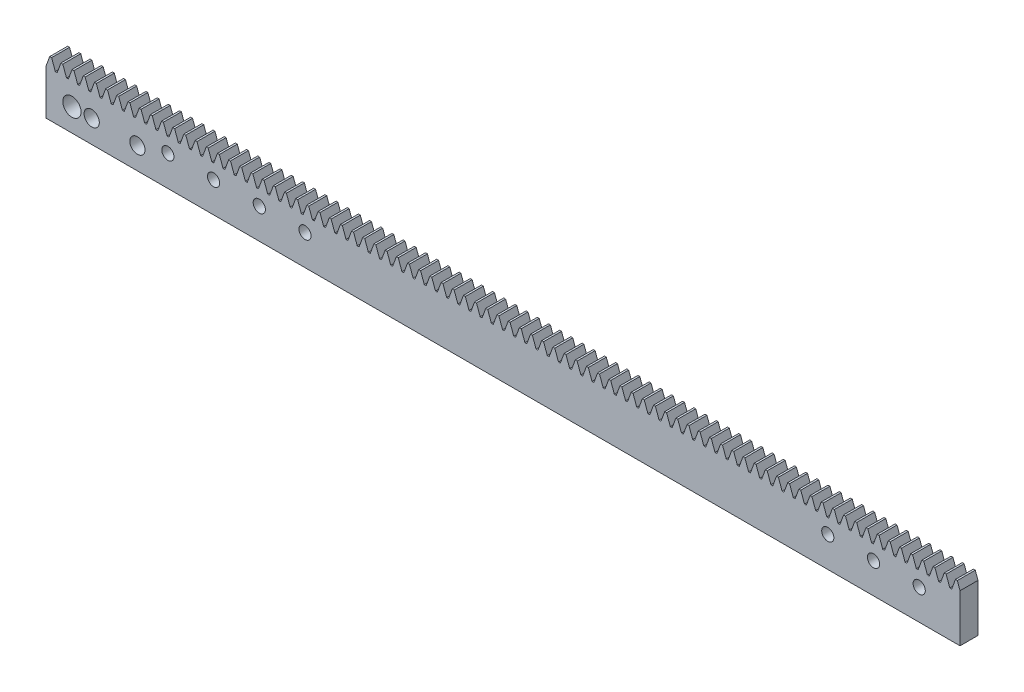
from build123d import *

# Parameters (mm, degrees)
CROQUIS1_R              = 3
CROQUIS1_R_2            = 2
SALIENTE_EXTRUIR1_DEPTH = 5.9
CROQUIS2_R              = 2.5
CROQUIS2_R_2            = 2
CROQUIS2_R_3            = 3
CROQUIS2_W              = 125.0496438
CROQUIS2_H              = 44.615702059
CORTAR_EXTRUIR2_DEPTH   = 16


with BuildPart() as part:
    # Croquis1 → Saliente-Extruir1 (new body)
    with BuildSketch(Plane.XY):
        with BuildLine():
            Line((-151.593916452, 22.65806142), (-152.811970556, 19.311485275))
            Line((-152.811970556, 19.311485275), (-152.811970556, 4.538535699))
            Line((-152.811970556, 4.538535699), (188.488029444, 4.538535699))
            Line((188.488029444, 4.538535699), (188.488029444, 19.311485275))
            Line((188.488029444, 19.311485275), (187.882745302, 19.311485275))
            Line((187.882745302, 19.311485275), (186.664691198, 22.65806142))
            Line((186.664691198, 22.65806142), (186.046083548, 22.65806142))
            Line((186.046083548, 22.65806142), (184.828029444, 19.311485275))
            Line((184.828029444, 19.311485275), (184.212745302, 19.311485275))
            Line((184.212745302, 19.311485275), (182.994691198, 22.65806142))
            Line((182.994691198, 22.65806142), (182.376083548, 22.65806142))
            Line((182.376083548, 22.65806142), (181.158029444, 19.311485275))
            Line((181.158029444, 19.311485275), (180.542745302, 19.311485275))
            Line((180.542745302, 19.311485275), (179.324691198, 22.65806142))
            Line((179.324691198, 22.65806142), (178.706083548, 22.65806142))
            Line((178.706083548, 22.65806142), (177.488029444, 19.311485275))
            Line((177.488029444, 19.311485275), (176.872745302, 19.311485275))
            Line((176.872745302, 19.311485275), (175.654691198, 22.65806142))
            Line((175.654691198, 22.65806142), (175.036083548, 22.65806142))
            Line((175.036083548, 22.65806142), (173.818029444, 19.311485275))
            Line((173.818029444, 19.311485275), (173.202745302, 19.311485275))
            Line((173.202745302, 19.311485275), (171.984691198, 22.65806142))
            Line((171.984691198, 22.65806142), (171.366083548, 22.65806142))
            Line((171.366083548, 22.65806142), (170.148029444, 19.311485275))
            Line((170.148029444, 19.311485275), (169.532745302, 19.311485275))
            Line((169.532745302, 19.311485275), (168.314691198, 22.65806142))
            Line((168.314691198, 22.65806142), (167.696083548, 22.65806142))
            Line((167.696083548, 22.65806142), (166.478029444, 19.311485275))
            Line((166.478029444, 19.311485275), (165.862745302, 19.311485275))
            Line((165.862745302, 19.311485275), (164.644691198, 22.65806142))
            Line((164.644691198, 22.65806142), (164.026083548, 22.65806142))
            Line((164.026083548, 22.65806142), (162.808029444, 19.311485275))
            Line((162.808029444, 19.311485275), (162.192745302, 19.311485275))
            Line((162.192745302, 19.311485275), (160.974691198, 22.65806142))
            Line((160.974691198, 22.65806142), (160.356083548, 22.65806142))
            Line((160.356083548, 22.65806142), (159.138029444, 19.311485275))
            Line((159.138029444, 19.311485275), (158.522745302, 19.311485275))
            Line((158.522745302, 19.311485275), (157.304691198, 22.65806142))
            Line((157.304691198, 22.65806142), (156.686083548, 22.65806142))
            Line((156.686083548, 22.65806142), (155.468029444, 19.311485275))
            Line((155.468029444, 19.311485275), (154.852745302, 19.311485275))
            Line((154.852745302, 19.311485275), (153.634691198, 22.65806142))
            Line((153.634691198, 22.65806142), (153.016083548, 22.65806142))
            Line((153.016083548, 22.65806142), (151.798029444, 19.311485275))
            Line((151.798029444, 19.311485275), (151.182745302, 19.311485275))
            Line((151.182745302, 19.311485275), (149.964691198, 22.65806142))
            Line((149.964691198, 22.65806142), (149.346083548, 22.65806142))
            Line((149.346083548, 22.65806142), (148.128029444, 19.311485275))
            Line((148.128029444, 19.311485275), (147.512745302, 19.311485275))
            Line((147.512745302, 19.311485275), (146.294691198, 22.65806142))
            Line((146.294691198, 22.65806142), (145.676083548, 22.65806142))
            Line((145.676083548, 22.65806142), (144.458029444, 19.311485275))
            Line((144.458029444, 19.311485275), (143.842745302, 19.311485275))
            Line((143.842745302, 19.311485275), (142.624691198, 22.65806142))
            Line((142.624691198, 22.65806142), (142.006083548, 22.65806142))
            Line((142.006083548, 22.65806142), (140.788029444, 19.311485275))
            Line((140.788029444, 19.311485275), (140.172745302, 19.311485275))
            Line((140.172745302, 19.311485275), (138.954691198, 22.65806142))
            Line((138.954691198, 22.65806142), (138.336083548, 22.65806142))
            Line((138.336083548, 22.65806142), (137.118029444, 19.311485275))
            Line((137.118029444, 19.311485275), (136.502745302, 19.311485275))
            Line((136.502745302, 19.311485275), (135.284691198, 22.65806142))
            Line((135.284691198, 22.65806142), (134.666083548, 22.65806142))
            Line((134.666083548, 22.65806142), (133.448029444, 19.311485275))
            Line((133.448029444, 19.311485275), (132.832745302, 19.311485275))
            Line((132.832745302, 19.311485275), (131.614691198, 22.65806142))
            Line((131.614691198, 22.65806142), (130.996083548, 22.65806142))
            Line((130.996083548, 22.65806142), (129.778029444, 19.311485275))
            Line((129.778029444, 19.311485275), (129.162745302, 19.311485275))
            Line((129.162745302, 19.311485275), (127.944691198, 22.65806142))
            Line((127.944691198, 22.65806142), (127.326083548, 22.65806142))
            Line((127.326083548, 22.65806142), (126.108029444, 19.311485275))
            Line((126.108029444, 19.311485275), (125.492745302, 19.311485275))
            Line((125.492745302, 19.311485275), (124.274691198, 22.65806142))
            Line((124.274691198, 22.65806142), (123.656083548, 22.65806142))
            Line((123.656083548, 22.65806142), (122.438029444, 19.311485275))
            Line((122.438029444, 19.311485275), (121.822745302, 19.311485275))
            Line((121.822745302, 19.311485275), (120.604691198, 22.65806142))
            Line((120.604691198, 22.65806142), (119.986083548, 22.65806142))
            Line((119.986083548, 22.65806142), (118.768029444, 19.311485275))
            Line((118.768029444, 19.311485275), (118.152745302, 19.311485275))
            Line((118.152745302, 19.311485275), (116.934691198, 22.65806142))
            Line((116.934691198, 22.65806142), (116.316083548, 22.65806142))
            Line((116.316083548, 22.65806142), (115.098029444, 19.311485275))
            Line((115.098029444, 19.311485275), (114.482745302, 19.311485275))
            Line((114.482745302, 19.311485275), (113.264691198, 22.65806142))
            Line((113.264691198, 22.65806142), (112.646083548, 22.65806142))
            Line((112.646083548, 22.65806142), (111.428029444, 19.311485275))
            Line((111.428029444, 19.311485275), (110.812745302, 19.311485275))
            Line((110.812745302, 19.311485275), (109.594691198, 22.65806142))
            Line((109.594691198, 22.65806142), (108.976083548, 22.65806142))
            Line((108.976083548, 22.65806142), (107.758029444, 19.311485275))
            Line((107.758029444, 19.311485275), (107.142745302, 19.311485275))
            Line((107.142745302, 19.311485275), (105.924691198, 22.65806142))
            Line((105.924691198, 22.65806142), (105.306083548, 22.65806142))
            Line((105.306083548, 22.65806142), (104.088029444, 19.311485275))
            Line((104.088029444, 19.311485275), (103.472745302, 19.311485275))
            Line((103.472745302, 19.311485275), (102.254691198, 22.65806142))
            Line((102.254691198, 22.65806142), (101.636083548, 22.65806142))
            Line((101.636083548, 22.65806142), (100.418029444, 19.311485275))
            Line((100.418029444, 19.311485275), (99.802745302, 19.311485275))
            Line((99.802745302, 19.311485275), (98.584691198, 22.65806142))
            Line((98.584691198, 22.65806142), (97.966083548, 22.65806142))
            Line((97.966083548, 22.65806142), (96.748029444, 19.311485275))
            Line((96.748029444, 19.311485275), (96.132745302, 19.311485275))
            Line((96.132745302, 19.311485275), (94.914691198, 22.65806142))
            Line((94.914691198, 22.65806142), (94.296083548, 22.65806142))
            Line((94.296083548, 22.65806142), (93.078029444, 19.311485275))
            Line((93.078029444, 19.311485275), (92.462745302, 19.311485275))
            Line((92.462745302, 19.311485275), (91.244691198, 22.65806142))
            Line((91.244691198, 22.65806142), (90.626083548, 22.65806142))
            Line((90.626083548, 22.65806142), (89.408029444, 19.311485275))
            Line((89.408029444, 19.311485275), (88.792745302, 19.311485275))
            Line((88.792745302, 19.311485275), (87.574691198, 22.65806142))
            Line((87.574691198, 22.65806142), (86.956083548, 22.65806142))
            Line((86.956083548, 22.65806142), (85.738029444, 19.311485275))
            Line((85.738029444, 19.311485275), (85.122745302, 19.311485275))
            Line((85.122745302, 19.311485275), (83.904691198, 22.65806142))
            Line((83.904691198, 22.65806142), (83.286083548, 22.65806142))
            Line((83.286083548, 22.65806142), (82.068029444, 19.311485275))
            Line((82.068029444, 19.311485275), (81.452745302, 19.311485275))
            Line((81.452745302, 19.311485275), (80.234691198, 22.65806142))
            Line((80.234691198, 22.65806142), (79.616083548, 22.65806142))
            Line((79.616083548, 22.65806142), (78.398029444, 19.311485275))
            Line((78.398029444, 19.311485275), (77.782745302, 19.311485275))
            Line((77.782745302, 19.311485275), (76.564691198, 22.65806142))
            Line((76.564691198, 22.65806142), (75.946083548, 22.65806142))
            Line((75.946083548, 22.65806142), (74.728029444, 19.311485275))
            Line((74.728029444, 19.311485275), (74.112745302, 19.311485275))
            Line((74.112745302, 19.311485275), (72.894691198, 22.65806142))
            Line((72.894691198, 22.65806142), (72.276083548, 22.65806142))
            Line((72.276083548, 22.65806142), (71.058029444, 19.311485275))
            Line((71.058029444, 19.311485275), (70.442745302, 19.311485275))
            Line((70.442745302, 19.311485275), (69.224691198, 22.65806142))
            Line((69.224691198, 22.65806142), (68.606083548, 22.65806142))
            Line((68.606083548, 22.65806142), (67.388029444, 19.311485275))
            Line((67.388029444, 19.311485275), (66.772745302, 19.311485275))
            Line((66.772745302, 19.311485275), (65.554691198, 22.65806142))
            Line((65.554691198, 22.65806142), (64.936083548, 22.65806142))
            Line((64.936083548, 22.65806142), (63.718029444, 19.311485275))
            Line((63.718029444, 19.311485275), (63.102745302, 19.311485275))
            Line((63.102745302, 19.311485275), (61.884691198, 22.65806142))
            Line((61.884691198, 22.65806142), (61.266083548, 22.65806142))
            Line((61.266083548, 22.65806142), (60.048029444, 19.311485275))
            Line((60.048029444, 19.311485275), (59.432745302, 19.311485275))
            Line((59.432745302, 19.311485275), (58.214691198, 22.65806142))
            Line((58.214691198, 22.65806142), (57.596083548, 22.65806142))
            Line((57.596083548, 22.65806142), (56.378029444, 19.311485275))
            Line((56.378029444, 19.311485275), (55.762745302, 19.311485275))
            Line((55.762745302, 19.311485275), (54.544691198, 22.65806142))
            Line((54.544691198, 22.65806142), (53.926083548, 22.65806142))
            Line((53.926083548, 22.65806142), (52.708029444, 19.311485275))
            Line((52.708029444, 19.311485275), (52.092745302, 19.311485275))
            Line((52.092745302, 19.311485275), (50.874691198, 22.65806142))
            Line((50.874691198, 22.65806142), (50.256083548, 22.65806142))
            Line((50.256083548, 22.65806142), (49.038029444, 19.311485275))
            Line((49.038029444, 19.311485275), (48.422745302, 19.311485275))
            Line((48.422745302, 19.311485275), (47.204691198, 22.65806142))
            Line((47.204691198, 22.65806142), (46.586083548, 22.65806142))
            Line((46.586083548, 22.65806142), (45.368029444, 19.311485275))
            Line((45.368029444, 19.311485275), (44.752745302, 19.311485275))
            Line((44.752745302, 19.311485275), (43.534691198, 22.65806142))
            Line((43.534691198, 22.65806142), (42.916083548, 22.65806142))
            Line((42.916083548, 22.65806142), (41.698029444, 19.311485275))
            Line((41.698029444, 19.311485275), (41.082745302, 19.311485275))
            Line((41.082745302, 19.311485275), (39.864691198, 22.65806142))
            Line((39.864691198, 22.65806142), (39.246083548, 22.65806142))
            Line((39.246083548, 22.65806142), (38.028029444, 19.311485275))
            Line((38.028029444, 19.311485275), (37.412745302, 19.311485275))
            Line((37.412745302, 19.311485275), (36.194691198, 22.65806142))
            Line((36.194691198, 22.65806142), (35.576083548, 22.65806142))
            Line((35.576083548, 22.65806142), (34.358029444, 19.311485275))
            Line((34.358029444, 19.311485275), (33.742745302, 19.311485275))
            Line((33.742745302, 19.311485275), (32.524691198, 22.65806142))
            Line((32.524691198, 22.65806142), (31.906083548, 22.65806142))
            Line((31.906083548, 22.65806142), (30.688029444, 19.311485275))
            Line((30.688029444, 19.311485275), (30.072745302, 19.311485275))
            Line((30.072745302, 19.311485275), (28.854691198, 22.65806142))
            Line((28.854691198, 22.65806142), (28.236083548, 22.65806142))
            Line((28.236083548, 22.65806142), (27.018029444, 19.311485275))
            Line((27.018029444, 19.311485275), (26.402745302, 19.311485275))
            Line((26.402745302, 19.311485275), (25.184691198, 22.65806142))
            Line((25.184691198, 22.65806142), (24.566083548, 22.65806142))
            Line((24.566083548, 22.65806142), (23.348029444, 19.311485275))
            Line((23.348029444, 19.311485275), (22.732745302, 19.311485275))
            Line((22.732745302, 19.311485275), (21.514691198, 22.65806142))
            Line((21.514691198, 22.65806142), (20.896083548, 22.65806142))
            Line((20.896083548, 22.65806142), (19.678029444, 19.311485275))
            Line((19.678029444, 19.311485275), (19.062745302, 19.311485275))
            Line((19.062745302, 19.311485275), (17.844691198, 22.65806142))
            Line((17.844691198, 22.65806142), (17.226083548, 22.65806142))
            Line((17.226083548, 22.65806142), (16.008029444, 19.311485275))
            Line((16.008029444, 19.311485275), (15.392745302, 19.311485275))
            Line((15.392745302, 19.311485275), (14.174691198, 22.65806142))
            Line((14.174691198, 22.65806142), (13.556083548, 22.65806142))
            Line((13.556083548, 22.65806142), (12.338029444, 19.311485275))
            Line((12.338029444, 19.311485275), (11.722745302, 19.311485275))
            Line((11.722745302, 19.311485275), (10.504691198, 22.65806142))
            Line((10.504691198, 22.65806142), (9.886083548, 22.65806142))
            Line((9.886083548, 22.65806142), (8.668029444, 19.311485275))
            Line((8.668029444, 19.311485275), (8.052745302, 19.311485275))
            Line((8.052745302, 19.311485275), (6.834691198, 22.65806142))
            Line((6.834691198, 22.65806142), (6.216083548, 22.65806142))
            Line((6.216083548, 22.65806142), (4.998029444, 19.311485275))
            Line((4.998029444, 19.311485275), (4.382745302, 19.311485275))
            Line((4.382745302, 19.311485275), (3.164691198, 22.65806142))
            Line((3.164691198, 22.65806142), (2.546083548, 22.65806142))
            Line((2.546083548, 22.65806142), (1.328029444, 19.311485275))
            Line((1.328029444, 19.311485275), (0.712745302, 19.311485275))
            Line((0.712745302, 19.311485275), (-0.505308802, 22.65806142))
            Line((-0.505308802, 22.65806142), (-1.123916452, 22.65806142))
            Line((-1.123916452, 22.65806142), (-2.341970556, 19.311485275))
            Line((-2.341970556, 19.311485275), (-2.957254698, 19.311485275))
            Line((-2.957254698, 19.311485275), (-4.175308802, 22.65806142))
            Line((-4.175308802, 22.65806142), (-4.793916452, 22.65806142))
            Line((-4.793916452, 22.65806142), (-6.011970556, 19.311485275))
            Line((-6.011970556, 19.311485275), (-6.627254698, 19.311485275))
            Line((-6.627254698, 19.311485275), (-7.845308802, 22.65806142))
            Line((-7.845308802, 22.65806142), (-8.463916452, 22.65806142))
            Line((-8.463916452, 22.65806142), (-9.681970556, 19.311485275))
            Line((-9.681970556, 19.311485275), (-10.297254698, 19.311485275))
            Line((-10.297254698, 19.311485275), (-11.515308802, 22.65806142))
            Line((-11.515308802, 22.65806142), (-12.133916452, 22.65806142))
            Line((-12.133916452, 22.65806142), (-13.351970556, 19.311485275))
            Line((-13.351970556, 19.311485275), (-13.967254698, 19.311485275))
            Line((-13.967254698, 19.311485275), (-15.185308802, 22.65806142))
            Line((-15.185308802, 22.65806142), (-15.803916452, 22.65806142))
            Line((-15.803916452, 22.65806142), (-17.021970556, 19.311485275))
            Line((-17.021970556, 19.311485275), (-17.637254698, 19.311485275))
            Line((-17.637254698, 19.311485275), (-18.855308802, 22.65806142))
            Line((-18.855308802, 22.65806142), (-19.473916452, 22.65806142))
            Line((-19.473916452, 22.65806142), (-20.691970556, 19.311485275))
            Line((-20.691970556, 19.311485275), (-21.307254698, 19.311485275))
            Line((-21.307254698, 19.311485275), (-22.525308802, 22.65806142))
            Line((-22.525308802, 22.65806142), (-23.143916452, 22.65806142))
            Line((-23.143916452, 22.65806142), (-24.361970556, 19.311485275))
            Line((-24.361970556, 19.311485275), (-24.977254698, 19.311485275))
            Line((-24.977254698, 19.311485275), (-26.195308802, 22.65806142))
            Line((-26.195308802, 22.65806142), (-26.813916452, 22.65806142))
            Line((-26.813916452, 22.65806142), (-28.031970556, 19.311485275))
            Line((-28.031970556, 19.311485275), (-28.647254698, 19.311485275))
            Line((-28.647254698, 19.311485275), (-29.865308802, 22.65806142))
            Line((-29.865308802, 22.65806142), (-30.483916452, 22.65806142))
            Line((-30.483916452, 22.65806142), (-31.701970556, 19.311485275))
            Line((-31.701970556, 19.311485275), (-32.317254698, 19.311485275))
            Line((-32.317254698, 19.311485275), (-33.535308802, 22.65806142))
            Line((-33.535308802, 22.65806142), (-34.153916452, 22.65806142))
            Line((-34.153916452, 22.65806142), (-35.371970556, 19.311485275))
            Line((-35.371970556, 19.311485275), (-35.987254698, 19.311485275))
            Line((-35.987254698, 19.311485275), (-37.205308802, 22.65806142))
            Line((-37.205308802, 22.65806142), (-37.823916452, 22.65806142))
            Line((-37.823916452, 22.65806142), (-39.041970556, 19.311485275))
            Line((-39.041970556, 19.311485275), (-39.657254698, 19.311485275))
            Line((-39.657254698, 19.311485275), (-40.875308802, 22.65806142))
            Line((-40.875308802, 22.65806142), (-41.493916452, 22.65806142))
            Line((-41.493916452, 22.65806142), (-42.711970556, 19.311485275))
            Line((-42.711970556, 19.311485275), (-43.327254698, 19.311485275))
            Line((-43.327254698, 19.311485275), (-44.545308802, 22.65806142))
            Line((-44.545308802, 22.65806142), (-45.163916452, 22.65806142))
            Line((-45.163916452, 22.65806142), (-46.381970556, 19.311485275))
            Line((-46.381970556, 19.311485275), (-46.997254698, 19.311485275))
            Line((-46.997254698, 19.311485275), (-48.215308802, 22.65806142))
            Line((-48.215308802, 22.65806142), (-48.833916452, 22.65806142))
            Line((-48.833916452, 22.65806142), (-50.051970556, 19.311485275))
            Line((-50.051970556, 19.311485275), (-50.667254698, 19.311485275))
            Line((-50.667254698, 19.311485275), (-51.885308802, 22.65806142))
            Line((-51.885308802, 22.65806142), (-52.503916452, 22.65806142))
            Line((-52.503916452, 22.65806142), (-53.721970556, 19.311485275))
            Line((-53.721970556, 19.311485275), (-54.337254698, 19.311485275))
            Line((-54.337254698, 19.311485275), (-55.555308802, 22.65806142))
            Line((-55.555308802, 22.65806142), (-56.173916452, 22.65806142))
            Line((-56.173916452, 22.65806142), (-57.391970556, 19.311485275))
            Line((-57.391970556, 19.311485275), (-58.007254698, 19.311485275))
            Line((-58.007254698, 19.311485275), (-59.225308802, 22.65806142))
            Line((-59.225308802, 22.65806142), (-59.843916452, 22.65806142))
            Line((-59.843916452, 22.65806142), (-61.061970556, 19.311485275))
            Line((-61.061970556, 19.311485275), (-61.677254698, 19.311485275))
            Line((-61.677254698, 19.311485275), (-62.895308802, 22.65806142))
            Line((-62.895308802, 22.65806142), (-63.513916452, 22.65806142))
            Line((-63.513916452, 22.65806142), (-64.731970556, 19.311485275))
            Line((-64.731970556, 19.311485275), (-65.347254698, 19.311485275))
            Line((-65.347254698, 19.311485275), (-66.565308802, 22.65806142))
            Line((-66.565308802, 22.65806142), (-67.183916452, 22.65806142))
            Line((-67.183916452, 22.65806142), (-68.401970556, 19.311485275))
            Line((-68.401970556, 19.311485275), (-69.017254698, 19.311485275))
            Line((-69.017254698, 19.311485275), (-70.235308802, 22.65806142))
            Line((-70.235308802, 22.65806142), (-70.853916452, 22.65806142))
            Line((-70.853916452, 22.65806142), (-72.071970556, 19.311485275))
            Line((-72.071970556, 19.311485275), (-72.687254698, 19.311485275))
            Line((-72.687254698, 19.311485275), (-73.905308802, 22.65806142))
            Line((-73.905308802, 22.65806142), (-74.523916452, 22.65806142))
            Line((-74.523916452, 22.65806142), (-75.741970556, 19.311485275))
            Line((-75.741970556, 19.311485275), (-76.357254698, 19.311485275))
            Line((-76.357254698, 19.311485275), (-77.575308802, 22.65806142))
            Line((-77.575308802, 22.65806142), (-78.193916452, 22.65806142))
            Line((-78.193916452, 22.65806142), (-79.411970556, 19.311485275))
            Line((-79.411970556, 19.311485275), (-80.027254698, 19.311485275))
            Line((-80.027254698, 19.311485275), (-81.245308802, 22.65806142))
            Line((-81.245308802, 22.65806142), (-81.863916452, 22.65806142))
            Line((-81.863916452, 22.65806142), (-83.081970556, 19.311485275))
            Line((-83.081970556, 19.311485275), (-83.697254698, 19.311485275))
            Line((-83.697254698, 19.311485275), (-84.915308802, 22.65806142))
            Line((-84.915308802, 22.65806142), (-85.533916452, 22.65806142))
            Line((-85.533916452, 22.65806142), (-86.751970556, 19.311485275))
            Line((-86.751970556, 19.311485275), (-87.367254698, 19.311485275))
            Line((-87.367254698, 19.311485275), (-88.585308802, 22.65806142))
            Line((-88.585308802, 22.65806142), (-89.203916452, 22.65806142))
            Line((-89.203916452, 22.65806142), (-90.421970556, 19.311485275))
            Line((-90.421970556, 19.311485275), (-91.037254698, 19.311485275))
            Line((-91.037254698, 19.311485275), (-92.255308802, 22.65806142))
            Line((-92.255308802, 22.65806142), (-92.873916452, 22.65806142))
            Line((-92.873916452, 22.65806142), (-94.091970556, 19.311485275))
            Line((-94.091970556, 19.311485275), (-94.707254698, 19.311485275))
            Line((-94.707254698, 19.311485275), (-95.925308802, 22.65806142))
            Line((-95.925308802, 22.65806142), (-96.543916452, 22.65806142))
            Line((-96.543916452, 22.65806142), (-97.761970556, 19.311485275))
            Line((-97.761970556, 19.311485275), (-98.377254698, 19.311485275))
            Line((-98.377254698, 19.311485275), (-99.595308802, 22.65806142))
            Line((-99.595308802, 22.65806142), (-100.213916452, 22.65806142))
            Line((-100.213916452, 22.65806142), (-101.431970556, 19.311485275))
            Line((-101.431970556, 19.311485275), (-102.047254698, 19.311485275))
            Line((-102.047254698, 19.311485275), (-103.265308802, 22.65806142))
            Line((-103.265308802, 22.65806142), (-103.883916452, 22.65806142))
            Line((-103.883916452, 22.65806142), (-105.101970556, 19.311485275))
            Line((-105.101970556, 19.311485275), (-105.717254698, 19.311485275))
            Line((-105.717254698, 19.311485275), (-106.935308802, 22.65806142))
            Line((-106.935308802, 22.65806142), (-107.553916452, 22.65806142))
            Line((-107.553916452, 22.65806142), (-108.771970556, 19.311485275))
            Line((-108.771970556, 19.311485275), (-109.387254698, 19.311485275))
            Line((-109.387254698, 19.311485275), (-110.605308802, 22.65806142))
            Line((-110.605308802, 22.65806142), (-111.223916452, 22.65806142))
            Line((-111.223916452, 22.65806142), (-112.441970556, 19.311485275))
            Line((-112.441970556, 19.311485275), (-113.057254698, 19.311485275))
            Line((-113.057254698, 19.311485275), (-114.275308802, 22.65806142))
            Line((-114.275308802, 22.65806142), (-114.893916452, 22.65806142))
            Line((-114.893916452, 22.65806142), (-116.111970556, 19.311485275))
            Line((-116.111970556, 19.311485275), (-116.727254698, 19.311485275))
            Line((-116.727254698, 19.311485275), (-117.945308802, 22.65806142))
            Line((-117.945308802, 22.65806142), (-118.563916452, 22.65806142))
            Line((-118.563916452, 22.65806142), (-119.781970556, 19.311485275))
            Line((-119.781970556, 19.311485275), (-120.397254698, 19.311485275))
            Line((-120.397254698, 19.311485275), (-121.615308802, 22.65806142))
            Line((-121.615308802, 22.65806142), (-122.233916452, 22.65806142))
            Line((-122.233916452, 22.65806142), (-123.451970556, 19.311485275))
            Line((-123.451970556, 19.311485275), (-124.067254698, 19.311485275))
            Line((-124.067254698, 19.311485275), (-125.285308802, 22.65806142))
            Line((-125.285308802, 22.65806142), (-125.903916452, 22.65806142))
            Line((-125.903916452, 22.65806142), (-127.121970556, 19.311485275))
            Line((-127.121970556, 19.311485275), (-127.737254698, 19.311485275))
            Line((-127.737254698, 19.311485275), (-128.955308802, 22.65806142))
            Line((-128.955308802, 22.65806142), (-129.573916452, 22.65806142))
            Line((-129.573916452, 22.65806142), (-130.791970556, 19.311485275))
            Line((-130.791970556, 19.311485275), (-131.407254698, 19.311485275))
            Line((-131.407254698, 19.311485275), (-132.625308802, 22.65806142))
            Line((-132.625308802, 22.65806142), (-133.243916452, 22.65806142))
            Line((-133.243916452, 22.65806142), (-134.461970556, 19.311485275))
            Line((-134.461970556, 19.311485275), (-135.077254698, 19.311485275))
            Line((-135.077254698, 19.311485275), (-136.295308802, 22.65806142))
            Line((-136.295308802, 22.65806142), (-136.913916452, 22.65806142))
            Line((-136.913916452, 22.65806142), (-138.131970556, 19.311485275))
            Line((-138.131970556, 19.311485275), (-138.747254698, 19.311485275))
            Line((-138.747254698, 19.311485275), (-139.965308802, 22.65806142))
            Line((-139.965308802, 22.65806142), (-140.583916452, 22.65806142))
            Line((-140.583916452, 22.65806142), (-141.801970556, 19.311485275))
            Line((-141.801970556, 19.311485275), (-142.417254698, 19.311485275))
            Line((-142.417254698, 19.311485275), (-143.635308802, 22.65806142))
            ThreePointArc((-143.635308802, 22.65806142), (-143.944612627, 22.603522811), (-144.253916452, 22.65806142))
            Line((-144.253916452, 22.65806142), (-145.471970556, 19.311485275))
            Line((-145.471970556, 19.311485275), (-146.087254698, 19.311485275))
            Line((-146.087254698, 19.311485275), (-147.305308802, 22.65806142))
            Line((-147.305308802, 22.65806142), (-147.923916452, 22.65806142))
            Line((-147.923916452, 22.65806142), (-149.141970556, 19.311485275))
            Line((-149.141970556, 19.311485275), (-149.757254698, 19.311485275))
            Line((-149.757254698, 19.311485275), (-150.975308802, 22.65806142))
            Line((-150.975308802, 22.65806142), (-151.593916452, 22.65806142))
        make_face()
        with Locations((-144.311970556, 12.038535699)):
            Circle(CROQUIS1_R, mode=Mode.SUBTRACT)
        with Locations((-112.811970556, 14.538535699)):
            Circle(CROQUIS1_R_2, mode=Mode.SUBTRACT)
    extrude(amount=SALIENTE_EXTRUIR1_DEPTH)

    # Croquis2 → Cortar-Extruir2 (cut)
    with BuildSketch(Plane.XY):
        with Locations((-137.811970556, 12.038535699)):
            Circle(CROQUIS2_R)
        with Locations((-122.811970556, 11.75806142)):
            Circle(CROQUIS2_R)
        with Locations((-97.811970556, 14.538535699)):
            Circle(CROQUIS2_R_2)
        with Locations((-82.811970556, 14.538535699)):
            Circle(CROQUIS2_R_2)
        with Locations((-67.811970556, 14.538535699)):
            Circle(CROQUIS2_R_2)
        with Locations((-112.811970556, 14.538535699)):
            Circle(CROQUIS2_R_2)
        with Locations((-144.311970556, 12.038535699)):
            Circle(CROQUIS2_R_3)
        with Locations(Location((103.788029444, 14.538535699, 0), (0, 0, 180))):
            Circle(CROQUIS2_R_2)
        with Locations(Location((118.788029444, 14.538535699, 0), (0, 0, 180))):
            Circle(CROQUIS2_R_2)
        with Locations(Location((133.788029444, 14.538535699, 0), (0, 0, 180))):
            Circle(CROQUIS2_R_2)
        with Locations((209.712851344, 16.513249612)):
            Rectangle(CROQUIS2_W, CROQUIS2_H)
    extrude(amount=CORTAR_EXTRUIR2_DEPTH, mode=Mode.SUBTRACT)


solid = part.part
